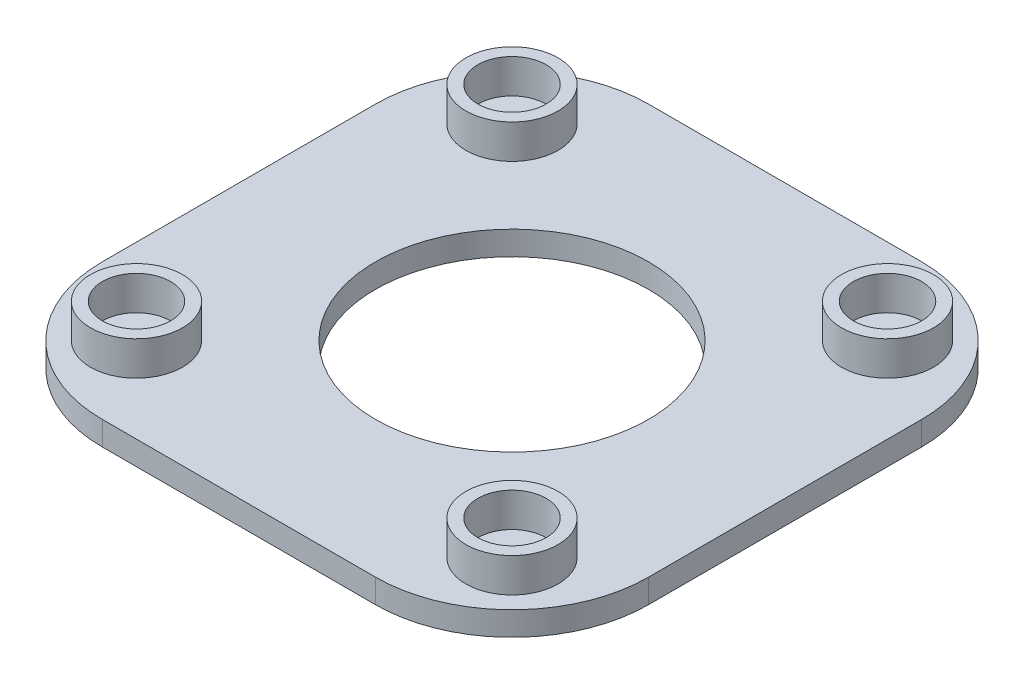
from build123d import *

# Parameters (mm, degrees)
IZIM1_R                     = 400
Y_KSEKLIK_EKSTR_ZYON1_DEPTH = 70
IZIM2_R                     = 135
IZIM2_R_2                   = 100
Y_KSEKLIK_EKSTR_ZYON2_DEPTH = 100


with BuildPart() as part:
    # Çizim1 → Yükseklik-Ekstrüzyon1 (new body)
    with BuildSketch(Plane(origin=(0, 0, 0), x_dir=(1, 0, 0), z_dir=(0, 1, 0))):
        with BuildLine():
            Line((800, 400), (800, -400))
            ThreePointArc((800, -400), (682.842712475, -682.842712475), (400, -800))
            Line((400, -800), (-400, -800))
            ThreePointArc((-400, -800), (-682.842712475, -682.842712475), (-800, -400))
            Line((-800, -400), (-800, 400))
            ThreePointArc((-800, 400), (-682.842712475, 682.842712475), (-400, 800))
            Line((-400, 800), (400, 800))
            ThreePointArc((400, 800), (682.842712475, 682.842712475), (800, 400))
        make_face()
        with Locations(Location((0, 0, 0), (0, 0, 270))):
            Circle(IZIM1_R, mode=Mode.SUBTRACT)
    extrude(amount=Y_KSEKLIK_EKSTR_ZYON1_DEPTH)

    # Çizim2 → Yükseklik-Ekstrüzyon2 (add)
    # profile 1 of 4: a face of its own
    with BuildSketch(Plane(origin=(0, 70, 0), x_dir=(1, 0, 0), z_dir=(0, 1, 0))):
        with Locations(Location((-550, 550, 0), (0, 0, 270))):
            Circle(IZIM2_R)
        with Locations(Location((-550, 550, 0), (0, 0, 270))):
            Circle(IZIM2_R_2, mode=Mode.SUBTRACT)
    # profile 2 of 4: a face of its own
    with BuildSketch(Plane(origin=(0, 70, 0), x_dir=(1, 0, 0), z_dir=(0, 1, 0))):
        with Locations(Location((550, 550, 0), (0, 0, 270))):
            Circle(IZIM2_R)
        with Locations(Location((550, 550, 0), (0, 0, 270))):
            Circle(IZIM2_R_2, mode=Mode.SUBTRACT)
    # profile 3 of 4: a face of its own
    with BuildSketch(Plane(origin=(0, 70, 0), x_dir=(1, 0, 0), z_dir=(0, 1, 0))):
        with Locations(Location((-550, -550, 0), (0, 0, 270))):
            Circle(IZIM2_R)
        with Locations(Location((-550, -550, 0), (0, 0, 270))):
            Circle(IZIM2_R_2, mode=Mode.SUBTRACT)
    # profile 4 of 4: a face of its own
    with BuildSketch(Plane(origin=(0, 70, 0), x_dir=(1, 0, 0), z_dir=(0, 1, 0))):
        with Locations(Location((550, -550, 0), (0, 0, 270))):
            Circle(IZIM2_R)
        with Locations(Location((550, -550, 0), (0, 0, 270))):
            Circle(IZIM2_R_2, mode=Mode.SUBTRACT)
    extrude(amount=Y_KSEKLIK_EKSTR_ZYON2_DEPTH)


solid = part.part
